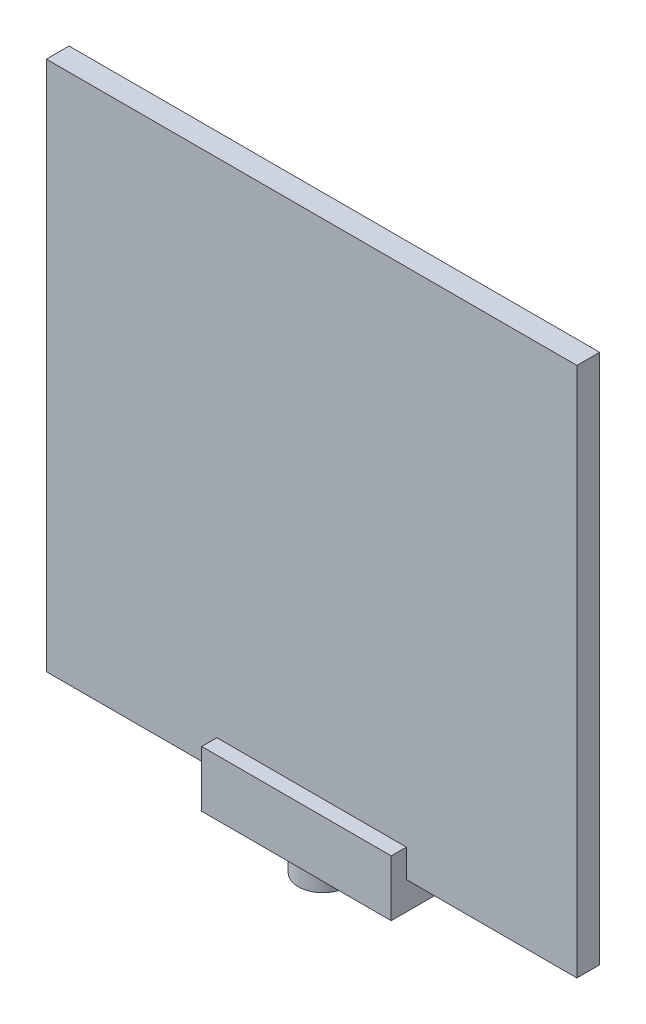
from build123d import *

# Parameters (mm, degrees)
SKETCH1_W                = 70
SKETCH1_H                = 70
BOSS_EXTRUDE1_DEPTH      = 3
BOSS_EXTRUDE2_DEPTH      = 2
BOSS_EXTRUDE2_DEPTH_BACK = 5
SKETCH2_W                = 25
SKETCH2_H                = 7.41284488
SKETCH3_R                = 2.25
CUT_EXTRUDE1_DEPTH       = 2.5
BOSS_EXTRUDE3_START      = 2.5
SKETCH4_R                = 3.25
SKETCH4_R_2              = 2.25
BOSS_EXTRUDE3_DEPTH      = 2.5


with BuildPart() as part:
    # Sketch1 → Boss-Extrude1 (new body)
    with BuildSketch(Plane.XY):
        Rectangle(SKETCH1_W, SKETCH1_H)
    extrude(amount=BOSS_EXTRUDE1_DEPTH)

    # Sketch2 → Boss-Extrude2 (add, two sides: drawn at the far end of the back side and taken through both)
    with BuildSketch(Plane(origin=(0, 0, 0), x_dir=(-1, 0, 0), z_dir=(0, 0, -1)).offset(-BOSS_EXTRUDE2_DEPTH_BACK)):
        with Locations((0, -35)):
            Rectangle(SKETCH2_W, SKETCH2_H)
    extrude(amount=BOSS_EXTRUDE2_DEPTH + BOSS_EXTRUDE2_DEPTH_BACK)

    # Sketch3 → Cut-Extrude1 (cut)
    with BuildSketch(Plane.XZ.offset(38.70642244)):
        with Locations(Location((0, 1.5, 0), (0, 0, 270))):
            Circle(SKETCH3_R)
    extrude(amount=-CUT_EXTRUDE1_DEPTH, mode=Mode.SUBTRACT)

    # Sketch4 → Boss-Extrude3 (add)
    with BuildSketch(Plane.XZ.offset(38.70642244).offset(BOSS_EXTRUDE3_START)):
        with Locations(Location((0, 1.5, 0), (0, 0, 270))):
            Circle(SKETCH4_R)
        with Locations(Location((0, 1.5, 0), (0, 0, 270))):
            Circle(SKETCH4_R_2, mode=Mode.SUBTRACT)
    extrude(amount=-BOSS_EXTRUDE3_DEPTH)


solid = part.part
